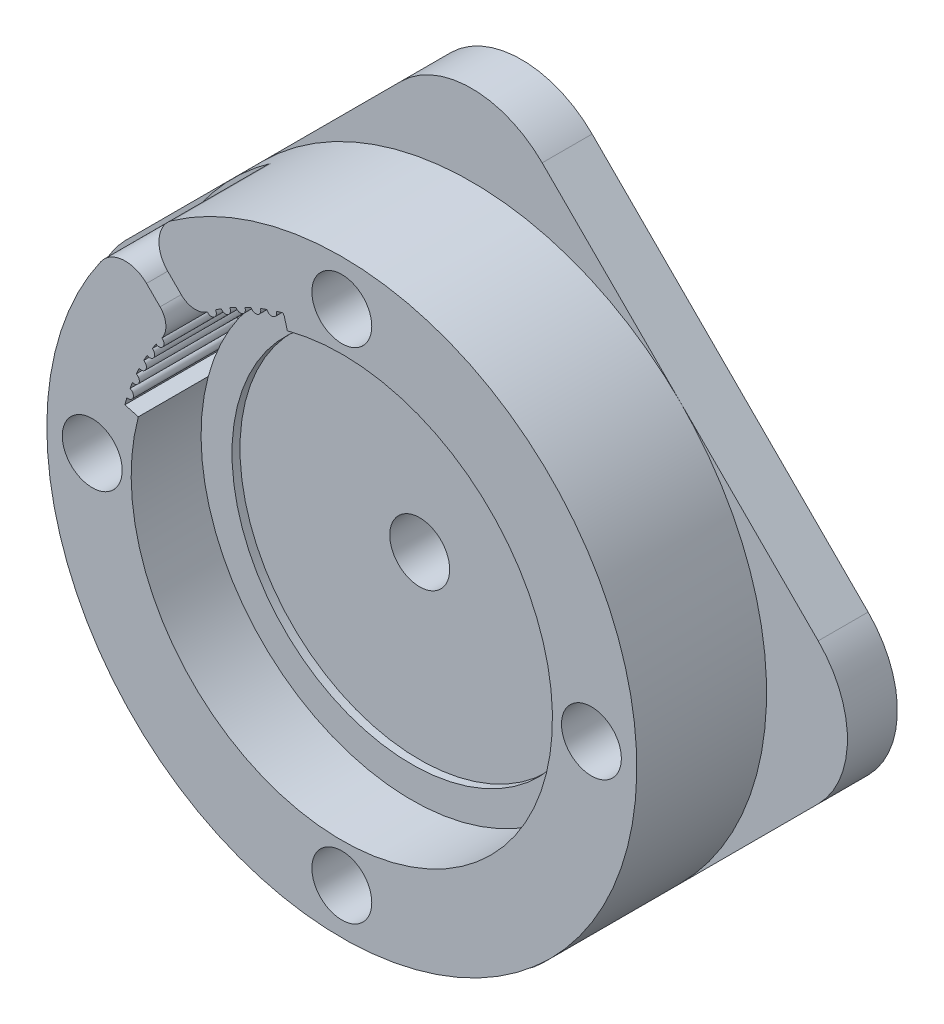
from build123d import *

# Parameters (mm, degrees)
SKETCH_01_W               = 8.999999864
SKETCH_01_H               = 30.367248618
CUT_EXTRUDE_01_DEPTH      = 4.499999932
CUT_EXTRUDE_01_DEPTH_BACK = 4.499999932
SKETCH_433_W              = 8.999999864
SKETCH_433_H              = 0.009842519
SKETCH_5_R                = 36.024182257
SKETCH_5_R_2              = 29.54824863
CUT_EXTRUDE_2_DEPTH       = 10
EXTRUDE_START             = 9
SKETCH_6_R                = 29.54824863
EXTRUDE_1_DEPTH           = 9
SKETCH_7_R                = 21.1
CUT_EXTRUDE_3_DEPTH       = 7
SKETCH_8_R                = 1.6
CUT_EXTRUDE_4_DEPTH       = 34
SKETCH_9_R                = 3
CUT_EXTRUDE_5_DEPTH       = 34
SKETCH_10_R               = 18
CUT_EXTRUDE_6_DEPTH       = 0.8
SKETCH_12_R               = 3
CUT_EXTRUDE_8_DEPTH       = 5
EXTRUDE_2_DEPTH           = 5
CUT_EXTRUDE_9_DEPTH       = 10
FILLET_1_R                = 3


with BuildPart() as part:
    # Sketch 01 → 同步带轮01 (revolve)
    with BuildSketch(Plane(origin=(0, 0, 0), x_dir=(0, 0, -1), z_dir=(1, 0, 0)), mode=Mode.PRIVATE) as revolve_01_sk:
        with Locations((0, 15.183624309)):
            Rectangle(SKETCH_01_W, SKETCH_01_H)
    revolve(revolve_01_sk.sketch.rotate(Axis((0, 0, 0), (0, 0, -1)), 90), axis=Axis((0, 0, 0), (0, 0, -1)))

    # Sketch 01 2 → 齿拉伸切除同步带轮01 (cut, two sides: drawn at the far end of the back side and taken through both)
    with BuildSketch(Plane.XY.offset(-CUT_EXTRUDE_01_DEPTH_BACK)):
        with BuildLine():
            Line((-0.813748126, 30.356343696), (0, 32.907248579))
            Line((0, 32.907248579), (0.813748126, 30.356343696))
            ThreePointArc((0.813748126, 30.356343696), (0.662957144, 30.297406109), (0.599999991, 30.148248621))
            ThreePointArc((0.599999991, 30.148248621), (0, 29.54824863), (-0.599999991, 30.148248621))
            ThreePointArc((-0.599999991, 30.148248621), (-0.662957144, 30.297406109), (-0.813748126, 30.356343696))
        make_face()
    extrude(amount=CUT_EXTRUDE_01_DEPTH + CUT_EXTRUDE_01_DEPTH_BACK, mode=Mode.SUBTRACT)

    # Sketch 433 → Cut-Revolve 471 (revolve, cut)
    with BuildSketch(Plane(origin=(0, 0, 0), x_dir=(0, 0, -1), z_dir=(1, 0, 0)), mode=Mode.PRIVATE) as cut_revolve_471_sk:
        with Locations((0, 0.00492126)):
            Rectangle(SKETCH_433_W, SKETCH_433_H)
    revolve(cut_revolve_471_sk.sketch.rotate(Axis((0, 0, 0), (0, 0, -1)), 90), axis=Axis((0, 0, 0), (0, 0, -1)), mode=Mode.SUBTRACT)

    # 草图5 → 切除-拉伸2 (cut)
    with BuildSketch(Plane(origin=(0, 0, -4.499999932), x_dir=(-1, 0, 0), z_dir=(0, 0, -1))):
        Circle(SKETCH_5_R)
        Circle(SKETCH_5_R_2, mode=Mode.SUBTRACT)
    extrude(amount=-CUT_EXTRUDE_2_DEPTH, mode=Mode.SUBTRACT)

    # 草图6 → 凸台-拉伸1 (add)
    with BuildSketch(Plane(origin=(0, 0, -4.499999932), x_dir=(-1, 0, 0), z_dir=(0, 0, -1)).offset(EXTRUDE_START)):
        Circle(SKETCH_6_R)
    extrude(amount=-EXTRUDE_1_DEPTH)

    # 草图7 → 切除-拉伸3 (cut)
    with BuildSketch(Plane.XY.offset(4.499999932)):
        Circle(SKETCH_7_R)
    extrude(amount=-CUT_EXTRUDE_3_DEPTH, mode=Mode.SUBTRACT)

    # 草图8 → 切除-拉伸4 (cut)
    with BuildSketch(Plane.XY.offset(4.499999932)):
        with Locations((0, 25)):
            Circle(SKETCH_8_R)
        with Locations((25, 0)):
            Circle(SKETCH_8_R)
        with Locations((0, -25)):
            Circle(SKETCH_8_R)
        with Locations((-25, 0)):
            Circle(SKETCH_8_R)
    extrude(amount=-CUT_EXTRUDE_4_DEPTH, mode=Mode.SUBTRACT)

    # 草图9 → 切除-拉伸5 (cut)
    with BuildSketch(Plane.XY.offset(-2.500000068)):
        Circle(SKETCH_9_R)
    extrude(amount=-CUT_EXTRUDE_5_DEPTH, mode=Mode.SUBTRACT)

    # 草图10 → 切除-拉伸6 (cut)
    with BuildSketch(Plane.XY.offset(-2.500000068)):
        Circle(SKETCH_10_R)
    extrude(amount=-CUT_EXTRUDE_6_DEPTH, mode=Mode.SUBTRACT)

    # 草图12 → 切除-拉伸8 (cut)
    with BuildSketch(Plane.XY.offset(4.499999932)):
        with Locations((0, -25)):
            Circle(SKETCH_12_R)
        with Locations((-25, 0)):
            Circle(SKETCH_12_R)
        with Locations((0, 25)):
            Circle(SKETCH_12_R)
        with Locations((25, 0)):
            Circle(SKETCH_12_R)
    extrude(amount=-CUT_EXTRUDE_8_DEPTH, mode=Mode.SUBTRACT)

    # 草图13 → 凸台-拉伸2 (add)
    with BuildSketch(Plane(origin=(0, 0, -13.499999932), x_dir=(-1, 0, 0), z_dir=(0, 0, -1))):
        with BuildLine():
            Line((-7.071067812, 34.716466145), (-20.893766978, 20.893766978))
            ThreePointArc((-20.893766978, 20.893766978), (0, 29.54824863), (20.893766978, 20.893766978))
            Line((20.893766978, 20.893766978), (7.071067812, 34.716466145))
            ThreePointArc((7.071067812, 34.716466145), (0, 37.645398333), (-7.071067812, 34.716466145))
        make_face()
        with BuildLine():
            Line((-34.716466145, -7.071067812), (-20.893766978, -20.893766978))
            ThreePointArc((-20.893766978, -20.893766978), (-29.54824863, 0), (-20.893766978, 20.893766978))
            Line((-20.893766978, 20.893766978), (-34.716466145, 7.071067812))
            ThreePointArc((-34.716466145, 7.071067812), (-37.645398333, 0), (-34.716466145, -7.071067812))
        make_face()
        with BuildLine():
            ThreePointArc((-7.071067812, -34.716466145), (0, -37.645398333), (7.071067812, -34.716466145))
            Line((7.071067812, -34.716466145), (20.893766881, -20.893767076))
            ThreePointArc((20.893766881, -20.893767076), (-6.9e-08, -29.54824863), (-20.893766978, -20.893766978))
            Line((-20.893766978, -20.893766978), (-7.071067812, -34.716466145))
        make_face()
        with BuildLine():
            ThreePointArc((29.54824863, 0), (27.299022104, -11.30762527), (20.893766881, -20.893767076))
            Line((20.893766881, -20.893767076), (34.716466145, -7.071067812))
            ThreePointArc((34.716466145, -7.071067812), (37.645398333, 0), (34.716466145, 7.071067812))
            Line((34.716466145, 7.071067812), (20.893766978, 20.893766978))
            ThreePointArc((20.893766978, 20.893766978), (27.299022131, 11.307625206), (29.54824863, 0))
        make_face()
    extrude(amount=-EXTRUDE_2_DEPTH)

    # 草图14 → 切除-拉伸9 (cut)
    with BuildSketch(Plane.XY.offset(4.499999932)):
        with BuildLine():
            Line((-21.733331092, 5.823428515), (-20.381034935, 5.461081852))
            ThreePointArc((-20.381034935, 5.461081852), (-14.919953083, 14.919953083), (-5.461081852, 20.381034935))
            Line((-5.461081852, 20.381034935), (-5.763920314, 21.511243463))
            ThreePointArc((-5.763920314, 21.511243463), (-5.832067357, 21.608637877), (-5.875298538, 21.719366176))
            ThreePointArc((-5.875298538, 21.719366176), (-6.212606996, 21.625298017), (-6.548410612, 21.525991695))
            ThreePointArc((-6.548410612, 21.525991695), (-6.869005795, 20.900161707), (-7.498359319, 21.213783433))
            ThreePointArc((-7.498359319, 21.213783433), (-7.827602785, 21.094516696), (-8.154950219, 20.970140365))
            ThreePointArc((-8.154950219, 20.970140365), (-8.427379648, 20.321891454), (-9.078615536, 20.5871013))
            ThreePointArc((-9.078615536, 20.5871013), (-9.397914516, 20.443316823), (-9.714937098, 20.294580488))
            ThreePointArc((-9.714937098, 20.294580488), (-9.937645604, 19.627613198), (-10.60704626, 19.842897209))
            ThreePointArc((-10.60704626, 19.842897209), (-10.914578029, 19.675415789), (-11.219466026, 19.503168514))
            ThreePointArc((-11.219466026, 19.503168514), (-11.391182272, 18.821290244), (-12.074926408, 18.985419464))
            ThreePointArc((-12.074926408, 18.985419464), (-12.368935412, 18.795197173), (-12.659948365, 18.600422237))
            ThreePointArc((-12.659948365, 18.600422237), (-12.779692104, 17.907525505), (-13.47387655, 18.019563))
            ThreePointArc((-13.47387655, 18.019563), (-14.814779333, 17.626436866), (-16.085768028, 18.207088371))
            Line((-16.085768028, 18.207088371), (-19.806167535, 21.927487879))
            ThreePointArc((-19.806167535, 21.927487879), (-20.893766978, 20.893766978), (-21.927487879, 19.806167535))
            Line((-21.927487879, 19.806167535), (-18.207088371, 16.085768028))
            ThreePointArc((-18.207088371, 16.085768028), (-17.626436866, 14.814779333), (-18.019563, 13.47387655))
            ThreePointArc((-18.019563, 13.47387655), (-17.907525505, 12.779692104), (-18.600422237, 12.659948365))
            ThreePointArc((-18.600422237, 12.659948365), (-18.795197173, 12.368935412), (-18.985419464, 12.074926408))
            ThreePointArc((-18.985419464, 12.074926408), (-18.821290244, 11.391182272), (-19.503168514, 11.219466026))
            ThreePointArc((-19.503168514, 11.219466026), (-19.675415789, 10.914578029), (-19.842897209, 10.60704626))
            ThreePointArc((-19.842897209, 10.60704626), (-19.627613198, 9.937645604), (-20.294580488, 9.714937098))
            ThreePointArc((-20.294580488, 9.714937098), (-20.443316823, 9.397914516), (-20.5871013, 9.078615536))
            ThreePointArc((-20.5871013, 9.078615536), (-20.321891454, 8.427379648), (-20.970140365, 8.154950219))
            ThreePointArc((-20.970140365, 8.154950219), (-21.094516696, 7.827602785), (-21.213783433, 7.498359319))
            ThreePointArc((-21.213783433, 7.498359319), (-20.900161707, 6.869005795), (-21.525991695, 6.548410612))
            ThreePointArc((-21.525991695, 6.548410612), (-21.63269867, 6.186788202), (-21.733331092, 5.823428515))
        make_face()
    extrude(amount=-CUT_EXTRUDE_9_DEPTH, mode=Mode.SUBTRACT)

    # 圆角1
    fillet_1_edges = [part.edges().sort_by_distance(p)[0] for p in [
        (-19.806167535, 21.927487879, -0.500000068),
        (-21.927487879, 19.806167535, -0.500000068),
    ]]
    fillet(fillet_1_edges, radius=FILLET_1_R)


solid = part.part
